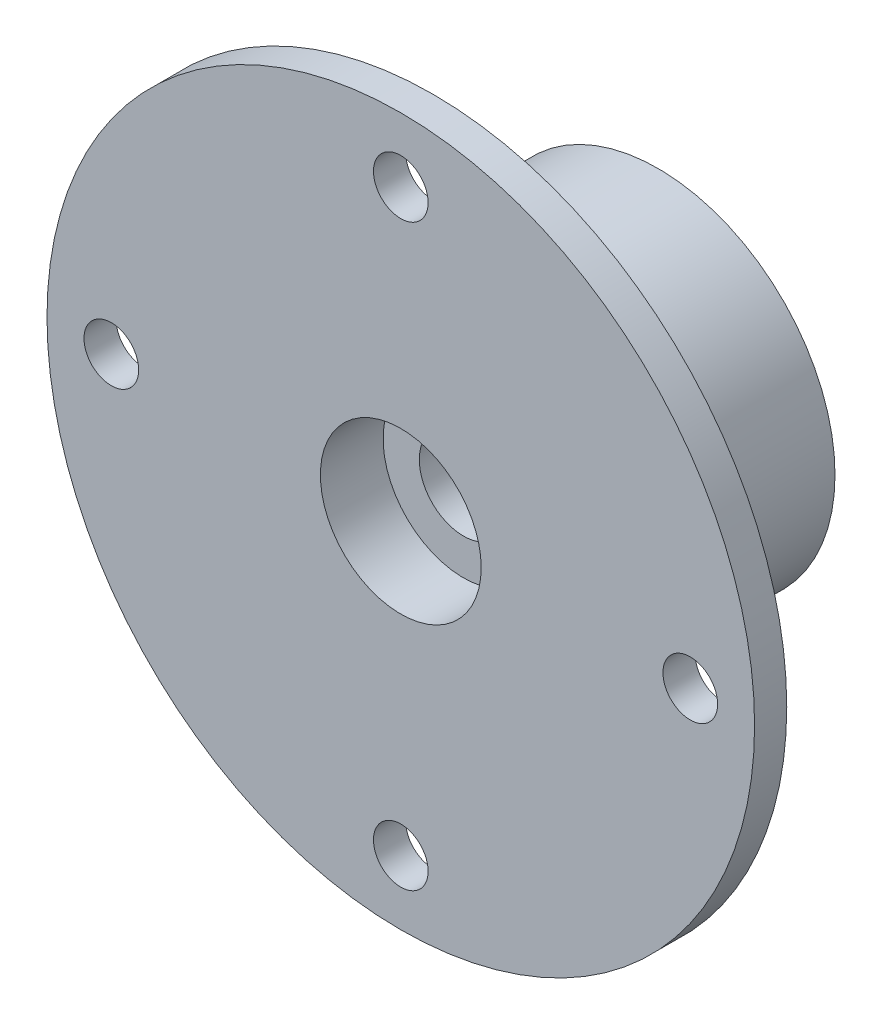
from build123d import *

# Parameters (mm, degrees)
SKETCH1_R                                            = 11
BOSS_EXTRUDE1_DEPTH                                  = 14
SKETCH2_R                                            = 22
BOSS_EXTRUDE2_DEPTH                                  = 2
M3_CLEARANCE_HOLE1_D                                 = 3.4
CBORE_FOR_M5_HEX_SOCKET_THIN_HEAD_CAP_SC_D           = 5.5
CBORE_FOR_M5_HEX_SOCKET_THIN_HEAD_CAP_SC_CBORE_D     = 10
CBORE_FOR_M5_HEX_SOCKET_THIN_HEAD_CAP_SC_CBORE_DEPTH = 3.9
FILLET1_R                                            = 0.5


with BuildPart() as part:
    # Sketch1 → Boss-Extrude1 (new body)
    with BuildSketch(Plane.XY):
        Circle(SKETCH1_R)
    extrude(amount=BOSS_EXTRUDE1_DEPTH)

    # Sketch2 → Boss-Extrude2 (add)
    with BuildSketch(Plane.XY.offset(14)):
        Circle(SKETCH2_R)
    extrude(amount=BOSS_EXTRUDE2_DEPTH)

    # M3 Clearance Hole1 (through all)
    with Locations(Plane.XY.offset(16)):
        with Locations((-18, 0), (0, 18), (18, 0), (0, -18)):
            Hole(M3_CLEARANCE_HOLE1_D / 2)

    # CBORE for M5 Hex Socket Thin Head Cap Screw1 (through all)
    with Locations(Plane.XY.offset(16)):
        with Locations((0, 0)):
            CounterBoreHole(CBORE_FOR_M5_HEX_SOCKET_THIN_HEAD_CAP_SC_D / 2, CBORE_FOR_M5_HEX_SOCKET_THIN_HEAD_CAP_SC_CBORE_D / 2, CBORE_FOR_M5_HEX_SOCKET_THIN_HEAD_CAP_SC_CBORE_DEPTH)

    # Fillet1
    fillet1_edges = [part.edges().sort_by_distance(p)[0] for p in [
        (-11, 0, 14),
    ]]
    fillet(fillet1_edges, radius=FILLET1_R)


solid = part.part
